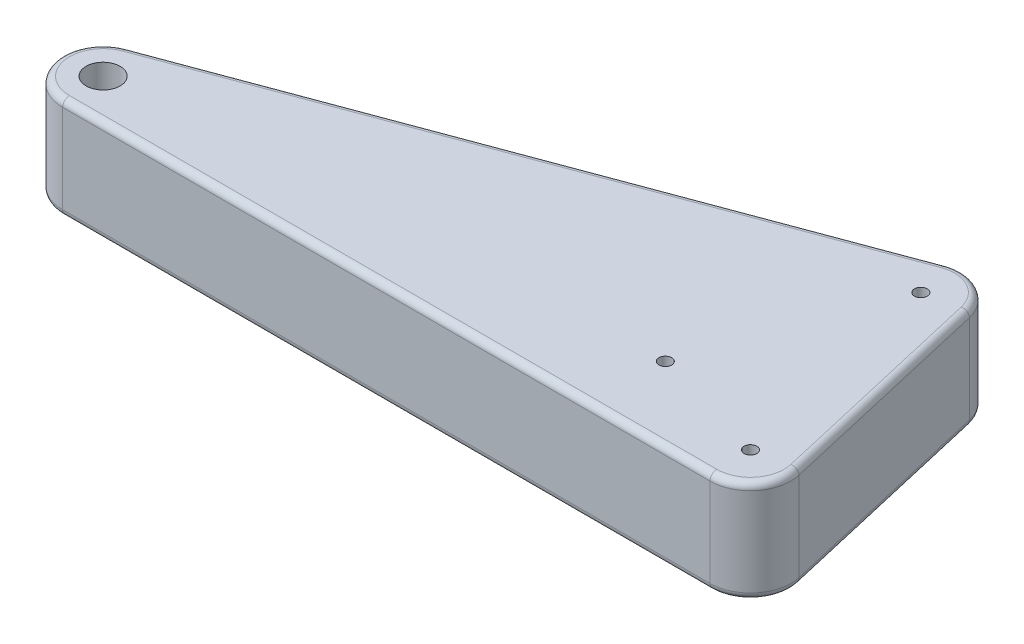
from build123d import *

# Parameters (mm, degrees)
SKETCH1_R           = 2.38125
BOSS_EXTRUDE1_DEPTH = 38.1
FILLET1_R           = 2.54
SKETCH2_R           = 6.35
CUT_EXTRUDE1_DEPTH  = 19.05


with BuildPart() as part:
    # Sketch1 → Boss-Extrude1 (new body)
    with BuildSketch(Plane(origin=(0, 0, 0), x_dir=(1, 0, 0), z_dir=(0, 1, 0))):
        with BuildLine():
            Line((216.9989119, 96.687544883), (-5.2510881, 14.137544883))
            ThreePointArc((-5.2510881, 14.137544883), (-14.843448897, -2.667606866), (0, -15.08125))
            Line((0, -15.08125), (241.3, -15.08125))
            ThreePointArc((241.3, -15.08125), (253.102268215, -9.388853313), (255.99503722, 3.391162435))
            Line((255.99503722, 3.391162435), (236.94503722, 85.941162435))
            ThreePointArc((236.94503722, 85.941162435), (229.403197025, 95.826892478), (216.9989119, 96.687544883))
        make_face()
        with Locations(Location((0, 0, 0), (0, 0, 90))):
            Circle(SKETCH1_R, mode=Mode.SUBTRACT)
        with Locations(Location((196.85, 12.7, 0), (0, 0, 90))):
            Circle(SKETCH1_R, mode=Mode.SUBTRACT)
        with Locations(Location((241.3, 0, 0), (0, 0, 90))):
            Circle(SKETCH1_R, mode=Mode.SUBTRACT)
        with Locations(Location((222.25, 82.55, 0), (0, 0, 90))):
            Circle(SKETCH1_R, mode=Mode.SUBTRACT)
    extrude(amount=BOSS_EXTRUDE1_DEPTH)

    # Fillet1
    fillet1_edges = [part.edges().sort_by_distance(p)[0] for p in [
        (229.403197025, 38.1, -95.826892478),
        (253.102268215, 0, 9.388853313),
        (120.65, 0, 15.08125),
        (-14.843448897, 0, 2.667606866),
        (105.8739119, 0, -55.412544883),
        (229.403197025, 0, -95.826892478),
        (246.47003722, 0, -44.666162435),
        (105.8739119, 38.1, -55.412544883),
        (-14.843448897, 38.1, 2.667606866),
        (120.65, 38.1, 15.08125),
        (253.102268215, 38.1, 9.388853313),
        (246.47003722, 38.1, -44.666162435),
    ]]
    fillet(fillet1_edges, radius=FILLET1_R)

    # Sketch2 → Cut-Extrude1 (cut)
    with BuildSketch(Plane(origin=(0, 38.1, 0), x_dir=(1, 0, 0), z_dir=(0, 1, 0))):
        with Locations(Location((0, 0, 0), (0, 0, 270))):
            Circle(SKETCH2_R)
    extrude(amount=-CUT_EXTRUDE1_DEPTH, mode=Mode.SUBTRACT)


solid = part.part
